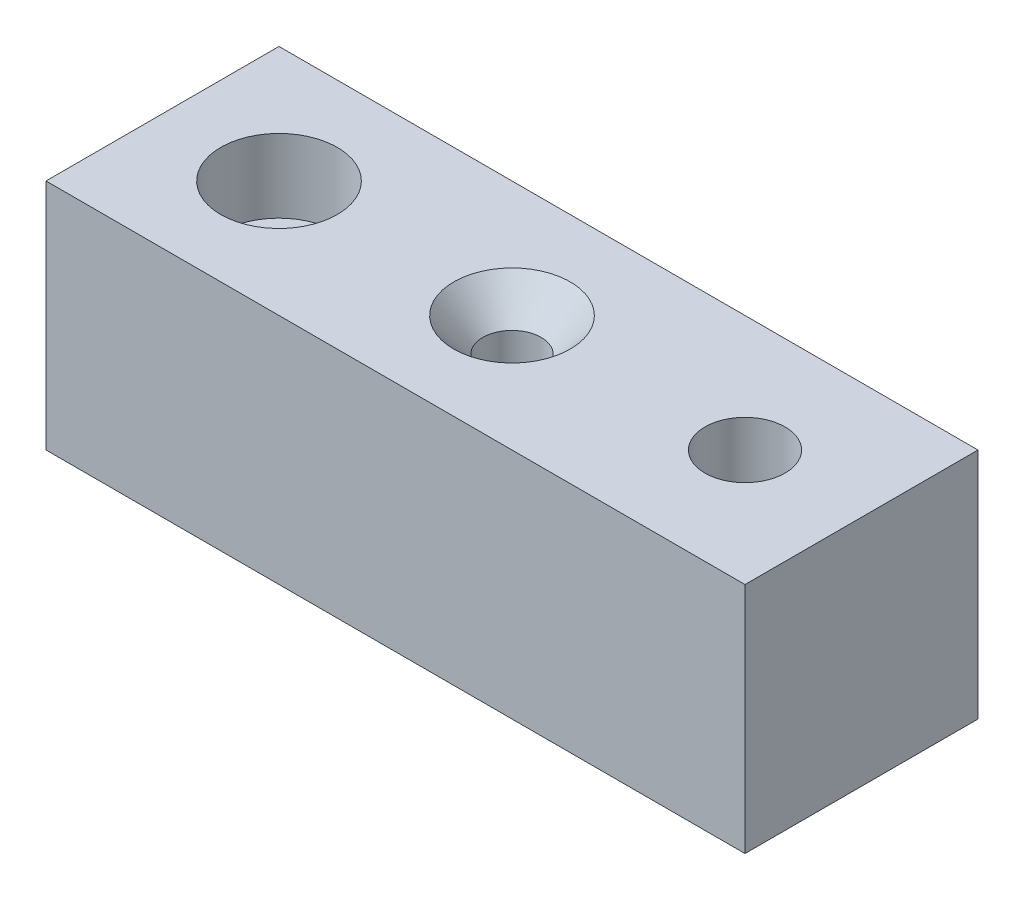
from build123d import *

# Parameters (mm, degrees)
SKETCH1_W                                           = 152.4
SKETCH1_H                                           = 50.8
BOSS_EXTRUDE1_DEPTH                                 = 50.8
F_3_4_16_TAPPED_HOLE1_D                             = 17.4625
F_3_4_16_TAPPED_HOLE1_DEPTH                         = 38.1
F_3_4_16_TAPPED_HOLE1_TIP                           = 5.24626428
CBORE_FOR_0_BINDING_HEAD_MACHINE_SCREW2_D           = 16.002
CBORE_FOR_0_BINDING_HEAD_MACHINE_SCREW2_CBORE_D     = 25.4
CBORE_FOR_0_BINDING_HEAD_MACHINE_SCREW2_CBORE_DEPTH = 16.002
CSK_FOR_0_FLAT_HEAD_MACHINE_SCREW_100_D             = 12.7
CSK_FOR_0_FLAT_HEAD_MACHINE_SCREW_100_CSINK_D       = 25.4
CSK_FOR_0_FLAT_HEAD_MACHINE_SCREW_100_CSINK_ANGLE   = 82


with BuildPart() as part:
    # Sketch1 → Boss-Extrude1 (new body)
    with BuildSketch(Plane(origin=(0, 0, 0), x_dir=(1, 0, 0), z_dir=(0, 1, 0))):
        with Locations((76.2, -25.4)):
            Rectangle(SKETCH1_W, SKETCH1_H)
    extrude(amount=BOSS_EXTRUDE1_DEPTH)

    # 3/4-16 Tapped Hole1
    with Locations(Plane(origin=(0, 50.8, 0), x_dir=(1, 0, 0), z_dir=(0, 1, 0))):
        with Locations((127, -25.4)):
            Hole(F_3_4_16_TAPPED_HOLE1_D / 2, depth=F_3_4_16_TAPPED_HOLE1_DEPTH)
            with Locations((0, 0, -(F_3_4_16_TAPPED_HOLE1_DEPTH + F_3_4_16_TAPPED_HOLE1_TIP / 2))):  # 118° drill point
                Cone(0, F_3_4_16_TAPPED_HOLE1_D / 2, F_3_4_16_TAPPED_HOLE1_TIP, mode=Mode.SUBTRACT)

    # CBORE for #0 Binding Head Machine Screw2 (through all)
    with Locations(Plane(origin=(0, 50.8, 0), x_dir=(1, 0, 0), z_dir=(0, 1, 0))):
        with Locations((25.4, -25.4)):
            CounterBoreHole(CBORE_FOR_0_BINDING_HEAD_MACHINE_SCREW2_D / 2, CBORE_FOR_0_BINDING_HEAD_MACHINE_SCREW2_CBORE_D / 2, CBORE_FOR_0_BINDING_HEAD_MACHINE_SCREW2_CBORE_DEPTH)

    # CSK for #0 Flat Head Machine Screw (100)3 (through all)
    with Locations(Plane(origin=(0, 50.8, 0), x_dir=(1, 0, 0), z_dir=(0, 1, 0))):
        with Locations((76.2, -25.4)):
            CounterSinkHole(CSK_FOR_0_FLAT_HEAD_MACHINE_SCREW_100_D / 2, CSK_FOR_0_FLAT_HEAD_MACHINE_SCREW_100_CSINK_D / 2, counter_sink_angle=CSK_FOR_0_FLAT_HEAD_MACHINE_SCREW_100_CSINK_ANGLE)


solid = part.part
